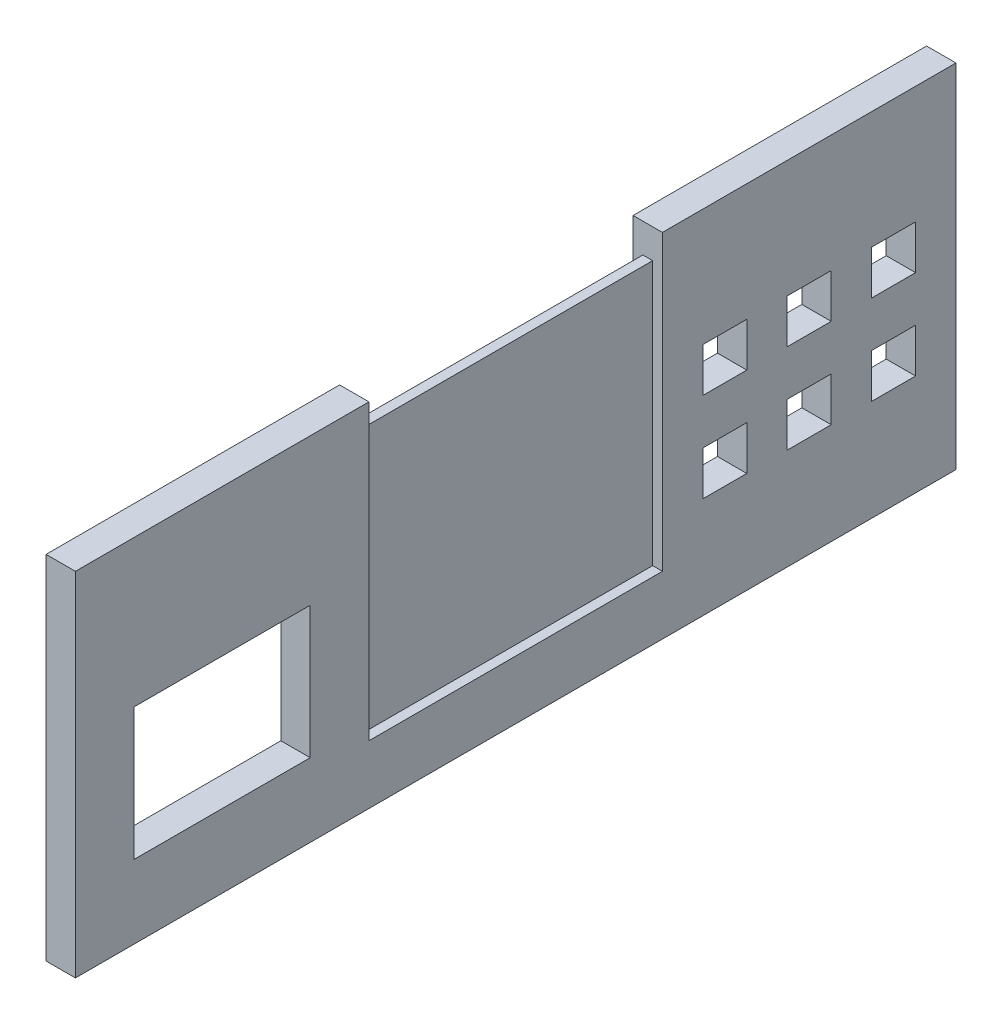
from build123d import *

# Parameters (mm, degrees)
SKETCH1_W           = 381
SKETCH1_H           = 152.4
BOSS_EXTRUDE2_DEPTH = 12.7
SKETCH2_W           = 127
SKETCH2_H           = 127
CUT_EXTRUDE1_DEPTH  = 12.7
SKETCH3_W           = 19.05
SKETCH3_H           = 19.05
SKETCH3_W_2         = 76.2
SKETCH3_H_2         = 57.15
CUT_EXTRUDE2_DEPTH  = 12.7
SKETCH4_W           = 4.233333334
SKETCH4_H           = 127
BOSS_EXTRUDE3_DEPTH = 114.3


with BuildPart() as part:
    # Sketch1 → Boss-Extrude2 (new body)
    with BuildSketch(Plane(origin=(0, 0, 0), x_dir=(0, 0, -1), z_dir=(1, 0, 0))):
        with Locations((-190.5, 76.2)):
            Rectangle(SKETCH1_W, SKETCH1_H)
    extrude(amount=BOSS_EXTRUDE2_DEPTH)

    # Sketch2 → Cut-Extrude1 (cut)
    with BuildSketch(Plane(origin=(12.7, 0, 0), x_dir=(0, 0, -1), z_dir=(1, 0, 0))):
        with Locations((-190.5, 88.9)):
            Rectangle(SKETCH2_W, SKETCH2_H)
    extrude(amount=-CUT_EXTRUDE1_DEPTH, mode=Mode.SUBTRACT)

    # Sketch3 → Cut-Extrude2 (cut)
    with BuildSketch(Plane(origin=(12.7, 0, 0), x_dir=(0, 0, -1), z_dir=(1, 0, 0))):
        with Locations((-100.0125, 92.075)):
            Rectangle(SKETCH3_W, SKETCH3_H)
        with Locations((-63.5, 92.075)):
            Rectangle(SKETCH3_W, SKETCH3_H)
        with Locations((-26.9875, 92.075)):
            Rectangle(SKETCH3_W, SKETCH3_H)
        with Locations((-100.0125, 53.340985209)):
            Rectangle(SKETCH3_W, SKETCH3_H)
        with Locations((-63.5, 53.340985209)):
            Rectangle(SKETCH3_W, SKETCH3_H)
        with Locations((-26.9875, 53.340985209)):
            Rectangle(SKETCH3_W, SKETCH3_H)
        with Locations((-317.5, 60.325)):
            Rectangle(SKETCH3_W_2, SKETCH3_H_2)
    extrude(amount=-CUT_EXTRUDE2_DEPTH, mode=Mode.SUBTRACT)

    # Sketch4 → Boss-Extrude3 (add)
    with BuildSketch(Plane(origin=(0, 25.4, 0), x_dir=(1, 0, 0), z_dir=(0, 1, 0))):
        with Locations((6.35, -190.5)):
            Rectangle(SKETCH4_W, SKETCH4_H)
    extrude(amount=BOSS_EXTRUDE3_DEPTH)


solid = part.part
